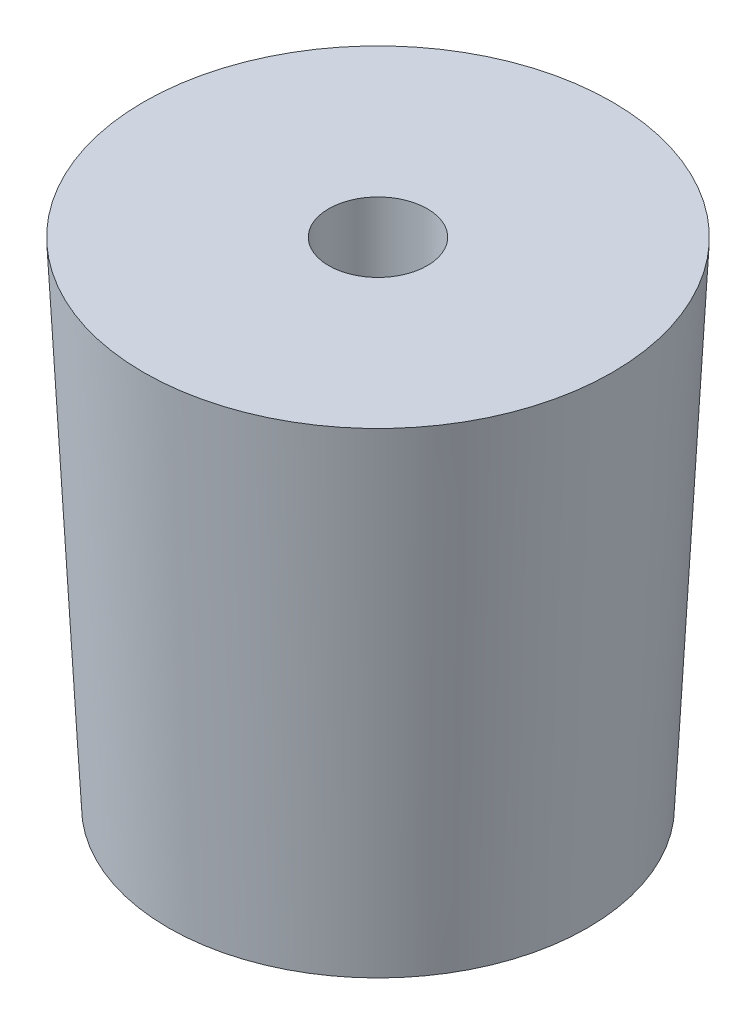
from build123d import *

# Parameters (mm, degrees)
SKETCH1_R           = 9.5
SKETCH1_R_2         = 2
BOSS_EXTRUDE1_DEPTH = 20
SKETCH3_R           = 5
CUT_EXTRUDE1_DEPTH  = 10


with BuildPart() as part:
    # Sketch1 → Boss-Extrude1 (new body)
    with BuildSketch(Plane(origin=(0, 0, 0), x_dir=(1, 0, 0), z_dir=(0, 1, 0))):
        with Locations(Location((0, 0, 0), (0, 0, 270))):
            Circle(SKETCH1_R)
        with Locations(Location((0, 0, 0), (0, 0, 270))):
            Circle(SKETCH1_R_2, mode=Mode.SUBTRACT)
    extrude(amount=BOSS_EXTRUDE1_DEPTH)

    # Sketch2 → Cut-Revolve1 (revolve, cut)
    with BuildSketch(Plane.XY, mode=Mode.PRIVATE) as cut_revolve1_sk:
        Polygon((-9.5, 20), (-8.5, 0), (-9.5, 0), align=None)
    revolve(cut_revolve1_sk.sketch.rotate(Axis((0, 20, 0), (0, -1, 0)), 270), axis=Axis((0, 20, 0), (0, -1, 0)), mode=Mode.SUBTRACT)

    # Sketch3 → Cut-Extrude1 (cut)
    with BuildSketch(Plane.XZ):
        with Locations(Location((0, 0, 0), (0, 0, 270))):
            Circle(SKETCH3_R)
    extrude(amount=-CUT_EXTRUDE1_DEPTH, mode=Mode.SUBTRACT)


solid = part.part
